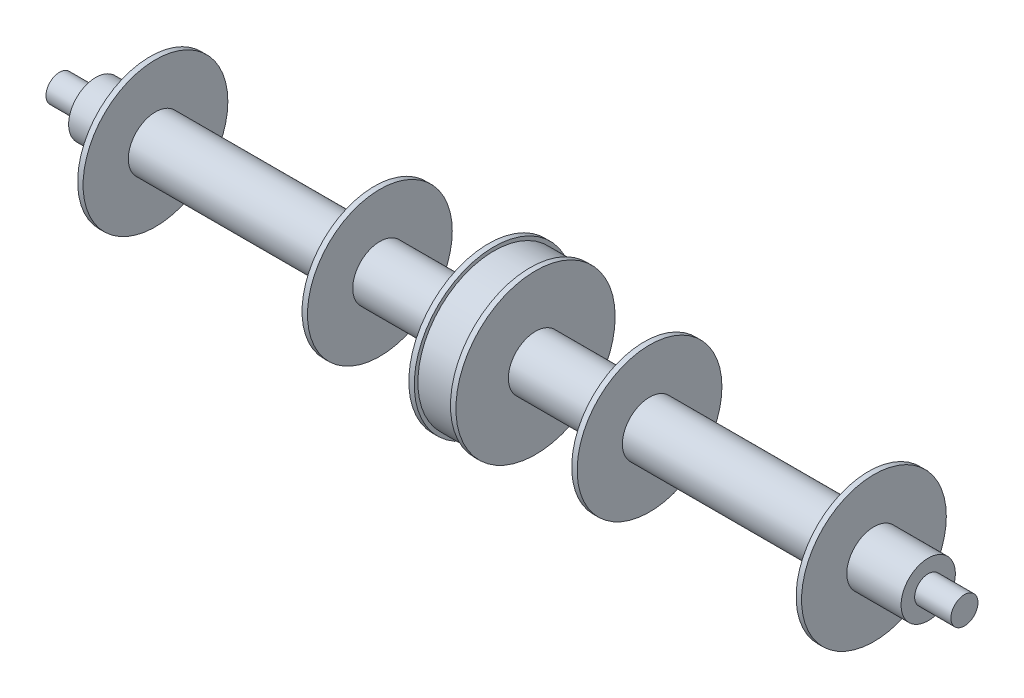
from build123d import *


with BuildPart() as part:
    # Sketch1 → Revolve1 (revolve)
    with BuildSketch(Plane.XY, mode=Mode.PRIVATE) as revolve1_sk:
        Polygon((-125, 0), (-125, 3.75), (-115, 3.75), (-115, 7.5), (-100, 7.5), (-100, 20), (-98.5, 20), (-98.5, 7.5), (-38, 7.5), (-38, 20), (-36.5, 20), (-36.5, 7.5), (-6.5, 7.5), (-6.5, 22), (-5, 22), (-5, 21), (5, 21), (5, 22), (6.5, 22), (6.5, 7.5), (36.5, 7.5), (36.5, 20), (38, 20), (38, 7.5), (98.5, 7.5), (98.5, 20), (100, 20), (100, 7.5), (115, 7.5), (115, 3.75), (125, 3.75), (125, 0), align=None)
    revolve(revolve1_sk.sketch.rotate(Axis((-7.951807229, 0, 0), (-1, 0, 0)), 90), axis=Axis((-7.951807229, 0, 0), (-1, 0, 0)))


solid = part.part
